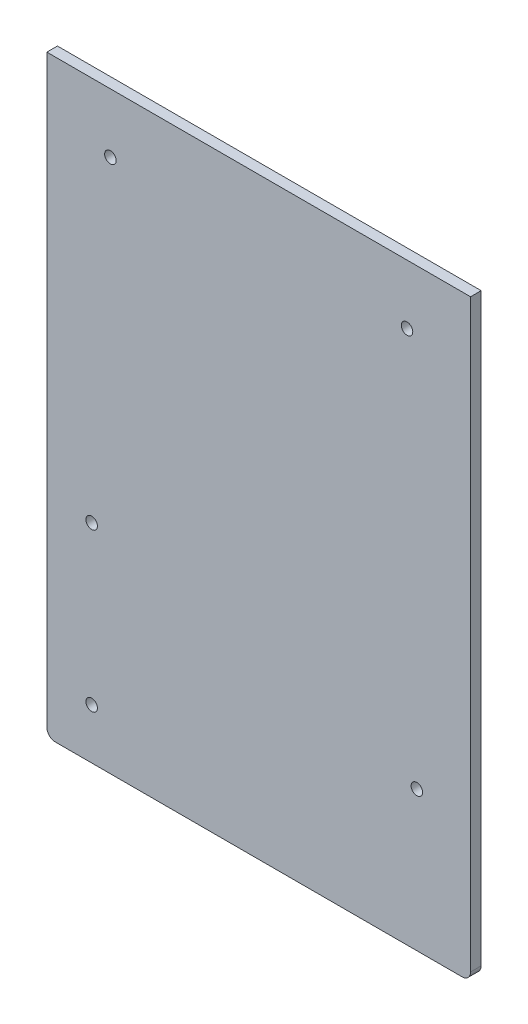
from build123d import *

# Parameters (mm, degrees)
SKETCH1_W                   = 127
SKETCH1_H                   = 177.8
BOSS_EXTRUDE1_DEPTH         = 3.175
F_29_0_136_DIAMETER_HOLE1_D = 3.4544
FILLET1_R                   = 2.54
TAP_DRILL_FOR_8_32_TAP1_D   = 3.4544


with BuildPart() as part:
    # Sketch1 → Boss-Extrude1 (new body)
    with BuildSketch(Plane.XY):
        with Locations((-71.487671776, 20.844565217)):
            Rectangle(SKETCH1_W, SKETCH1_H)
    extrude(amount=BOSS_EXTRUDE1_DEPTH)

    # #29 (0.136) Diameter Hole1 (through all)
    with Locations(Plane.XY.offset(3.175)):
        with Locations((-27.037671776, 91.964565217), (-115.937671776, 91.964565217)):
            Hole(F_29_0_136_DIAMETER_HOLE1_D / 2)

    # Fillet1
    fillet1_edges = [part.edges().sort_by_distance(p)[0] for p in [
        (-7.987671776, -68.055434783, 1.5875),
        (-134.987671776, -68.055434783, 1.5875),
    ]]
    fillet(fillet1_edges, radius=FILLET1_R)

    # Tap Drill for #8-32 Tap1 (through all)
    with Locations(Plane.XY.offset(3.175)):
        with Locations((-121.550284352, -52.958757681), (-121.550284352, -5.714757681), (-24.091492851, -26.100306068)):
            Hole(TAP_DRILL_FOR_8_32_TAP1_D / 2)


solid = part.part
